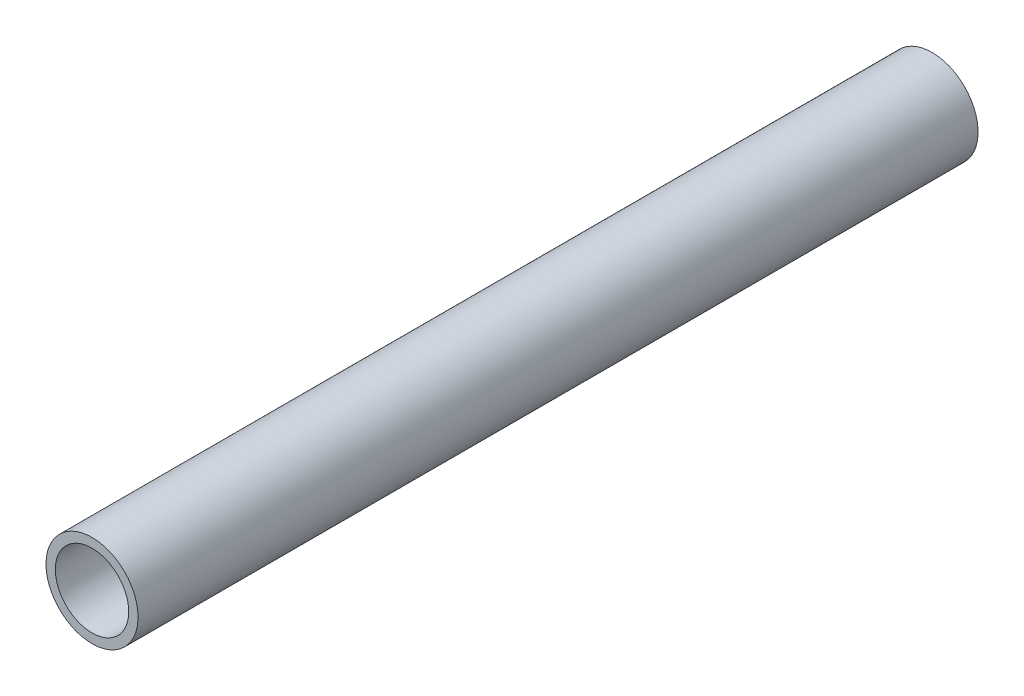
from build123d import *

# Parameters (mm, degrees)
SKETCH1_R           = 16.7005
SKETCH1_R_2         = 13.3223
EXTRUDE_THIN1_DEPTH = 152.4


with BuildPart() as part:
    # Sketch1 → Extrude-Thin1 (new, symmetric)
    with BuildSketch(Plane.XY):
        Circle(SKETCH1_R)
        Circle(SKETCH1_R_2, mode=Mode.SUBTRACT)
    extrude(amount=EXTRUDE_THIN1_DEPTH, both=True)


solid = part.part
